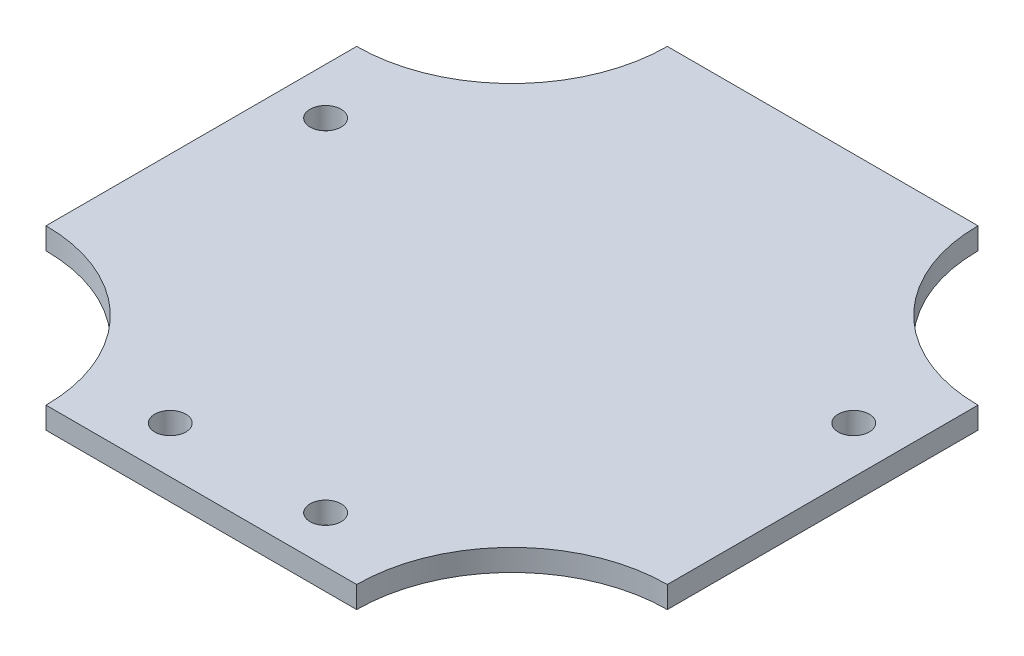
from build123d import *

# Parameters (mm, degrees)
SKETCH1_R           = 5
BOSS_EXTRUDE1_DEPTH = 7


with BuildPart() as part:
    # Sketch1 → Boss-Extrude1 (new body)
    with BuildSketch(Plane(origin=(0, 0, 0), x_dir=(1, 0, 0), z_dir=(0, 1, 0))):
        with BuildLine():
            Line((-50, 100), (50, 100))
            ThreePointArc((50, 100), (64.644660941, 64.644660941), (100, 50))
            Line((100, 50), (100, -50))
            ThreePointArc((100, -50), (64.644660941, -64.644660941), (50, -100))
            Line((50, -100), (-50, -100))
            ThreePointArc((-50, -100), (-64.644660941, -64.644660941), (-100, -50))
            Line((-100, -50), (-100, 50))
            ThreePointArc((-100, 50), (-64.644660941, 64.644660941), (-50, 100))
        make_face()
        with Locations(Location((-85, 25, 0), (0, 0, 270))):
            Circle(SKETCH1_R, mode=Mode.SUBTRACT)
        with Locations(Location((85, 25, 0), (0, 0, 270))):
            Circle(SKETCH1_R, mode=Mode.SUBTRACT)
        with Locations(Location((-25, -85, 0), (0, 0, 270))):
            Circle(SKETCH1_R, mode=Mode.SUBTRACT)
        with Locations(Location((25, -85, 0), (0, 0, 270))):
            Circle(SKETCH1_R, mode=Mode.SUBTRACT)
    extrude(amount=BOSS_EXTRUDE1_DEPTH)


solid = part.part
